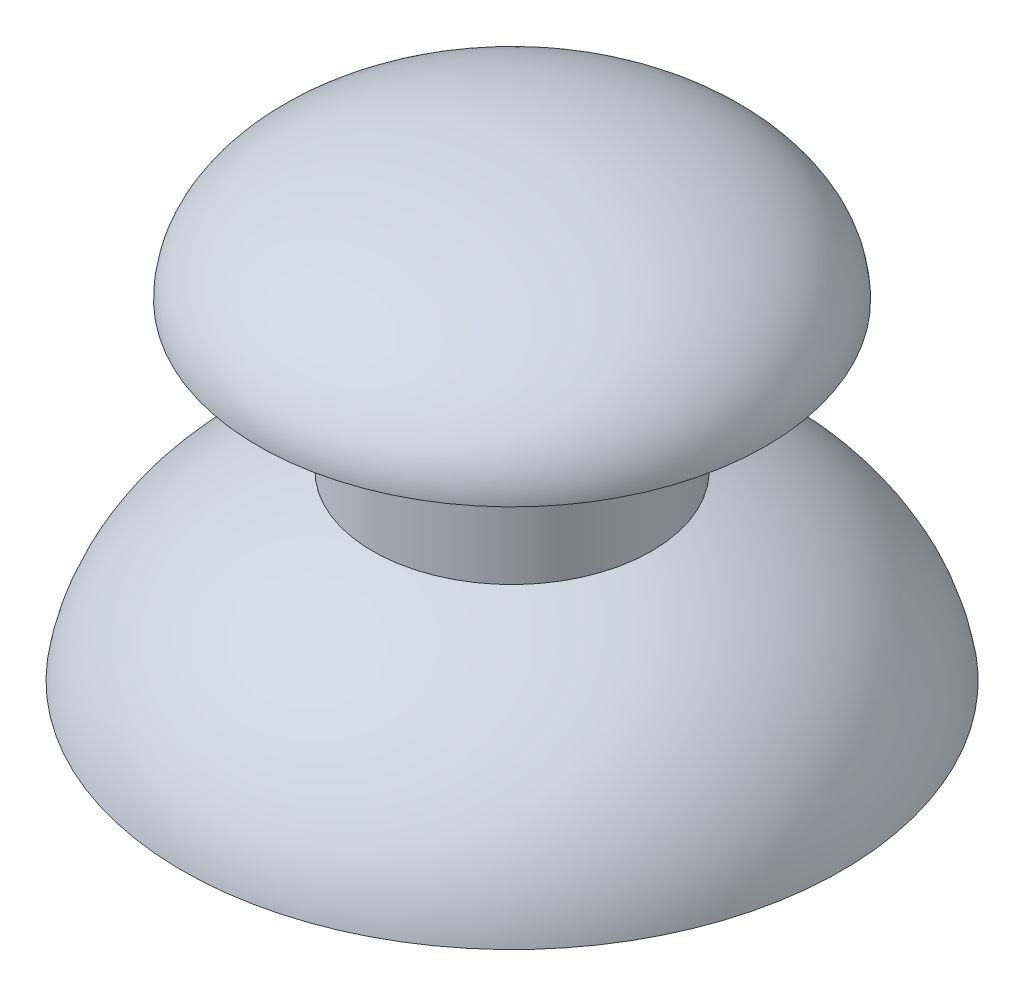
from build123d import *

# Parameters (mm, degrees)
SKETCH_5_R               = 3
EXTRUDE_1_DEPTH          = 6
CUT_EXTRUDE_START        = 6
SKETCH_5_3_R             = 4.5
SKETCH_5_3_R_2           = 3
CUT_EXTRUDE_3_DEPTH      = 15
EXTRUDE_5_DEPTH          = 0.5
PATTERN_CIRCULAR_1_COUNT = 4
SKETCH_10_W              = 2.1
SKETCH_10_H              = 1.2
CUT_EXTRUDE_4_DEPTH      = 4


with BuildPart() as part:
    # 草图3 → 旋转1 (revolve)
    with BuildSketch(Plane.XY):
        with BuildLine():
            Line((-5.5, 4), (-5.5, -1.83418875))
            add(Edge.make_bspline(
                [(-5.5, -1.83418875), (-12.181741823, -3.964565067), (-13, -9)],
                knots=[5.146338177, 5.146338177, 5.146338177, 6.171844293, 6.171844293, 6.171844293], degree=2, weights=[1, 0.871397222, 1]))
            Line((-13, -9), (0, -9))
            Line((0, -9), (0, 9))
            add(Edge.make_bspline(
                [(0, 9), (-10, 9), (-10, 4)],
                knots=[4.71238898, 4.71238898, 4.71238898, 6.283185307, 6.283185307, 6.283185307], degree=2, weights=[1, 0.707106781, 1]))
            Line((-10, 4), (-5.5, 4))
        make_face()
    revolve(axis=Axis((0, 9, 0), (0, -1, 0)))

    # 草图4 → 切除-旋转7 (revolve, cut)
    with BuildSketch(Plane.XY):
        with BuildLine():
            add(Edge.make_bspline(
                [(0, -2), (-10.654438473, -2), (-11.986243283, -9)],
                knots=[4.71238898, 4.71238898, 4.71238898, 6.157857476, 6.157857476, 6.157857476], degree=2, weights=[1, 0.75, 1]))
            Line((-11.986243283, -9), (0, -9))
            Line((0, -9), (0, -2))
        make_face()
    revolve(axis=Axis((0, 9, 0), (0, -1, 0)), mode=Mode.SUBTRACT)

    # 草图5 → 凸台-拉伸1 (add)
    with BuildSketch(Plane(origin=(0, 0, 0), x_dir=(1, 0, 0), z_dir=(0, 1, 0))):
        with Locations(Location((0, 0, 0), (0, 0, 180))):
            Circle(SKETCH_5_R)
    extrude(amount=-EXTRUDE_1_DEPTH)

    # 草图5<3> → 切除-拉伸3 (cut)
    with BuildSketch(Plane(origin=(0, 0, 0), x_dir=(1, 0, 0), z_dir=(0, 1, 0)).offset(CUT_EXTRUDE_START)):
        with Locations(Location((0, 0, 0), (0, 0, 180))):
            Circle(SKETCH_5_3_R)
        with Locations(Location((0, 0, 0), (0, 0, 180))):
            Circle(SKETCH_5_3_R_2, mode=Mode.SUBTRACT)
    extrude(amount=-CUT_EXTRUDE_3_DEPTH, mode=Mode.SUBTRACT)

    # 草图9 → 凸台-拉伸5 (add, symmetric)
    with BuildSketch(Plane.XY):
        with BuildLine():
            Line((-2.9, -5), (-2.9, -2.132902601))
            add(Edge.make_bspline(
                [(-2.9, -2.132902601), (-6.986239546, -2.79895993), (-9.583283499, -5)],
                knots=[4.952773119, 4.952773119, 4.952773119, 5.617899581, 5.617899581, 5.617899581], degree=2, weights=[1, 0.94520864, 1]))
            Line((-9.583283499, -5), (-2.9, -5))
        make_face()
    extrude_5 = extrude(amount=EXTRUDE_5_DEPTH, both=True)

    # 阵列(圆周)1: 凸台-拉伸5 ×4 about axis
    pattern_circular_1_axis = Axis((0, 0, 0), (0, -1, 0))
    for i in range(1, PATTERN_CIRCULAR_1_COUNT):
        add(extrude_5.rotate(pattern_circular_1_axis, i * 360 / PATTERN_CIRCULAR_1_COUNT))

    # 草图10 → 切除-拉伸4 (cut)
    with BuildSketch(Plane.XZ.offset(6)):
        Rectangle(SKETCH_10_W, SKETCH_10_H)
    extrude(amount=-CUT_EXTRUDE_4_DEPTH, mode=Mode.SUBTRACT)


solid = part.part
